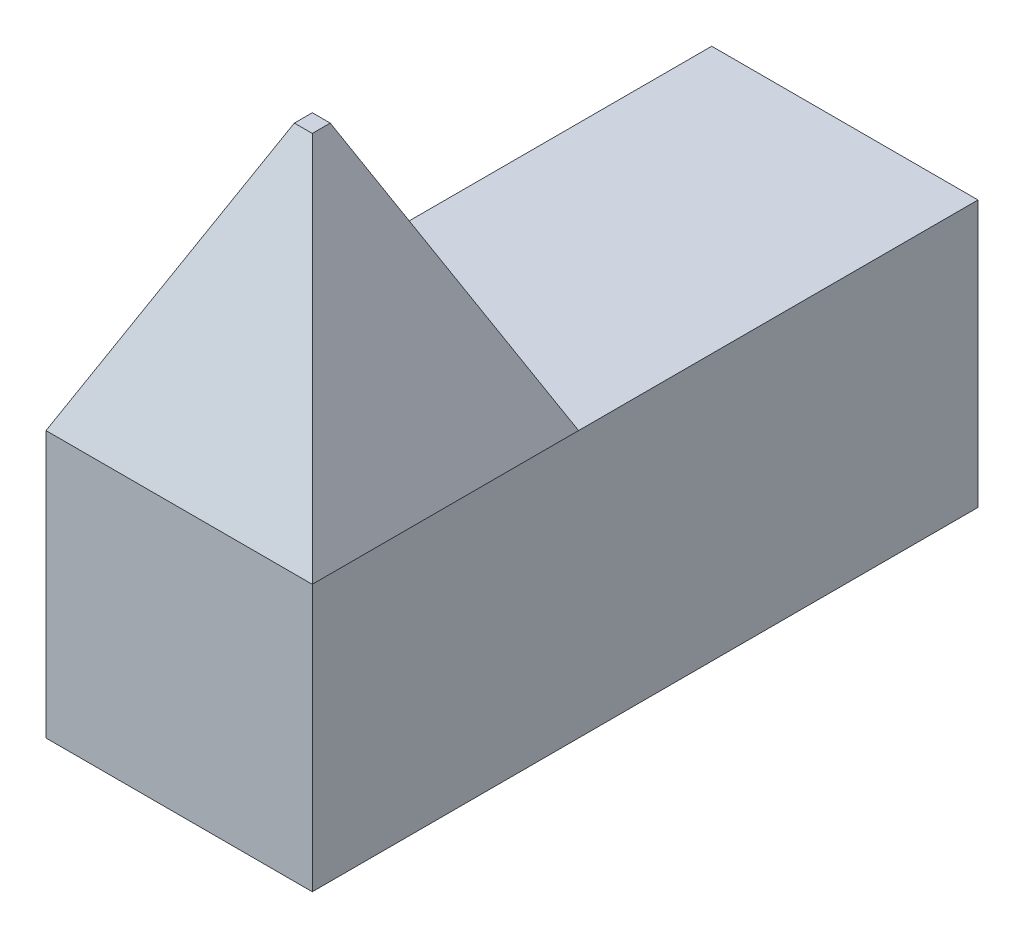
from build123d import *

# Parameters (mm, degrees)
SKETCH1_W           = 40
SKETCH1_H           = 40
BOSS_EXTRUDE1_DEPTH = 100
SKETCH2_W           = 40
SKETCH2_H           = 40
BOSS_EXTRUDE2_DEPTH = 40
BOSS_EXTRUDE2_TAPER = 25


with BuildPart() as part:
    # Sketch1 → Boss-Extrude1 (new body)
    with BuildSketch(Plane.XY):
        with Locations((20, 20)):
            Rectangle(SKETCH1_W, SKETCH1_H)
    extrude(amount=BOSS_EXTRUDE1_DEPTH)

    # Sketch2 → Boss-Extrude2 (add)
    with BuildSketch(Plane(origin=(0, 40, 0), x_dir=(1, 0, 0), z_dir=(0, 1, 0))):
        with Locations((20, -80)):
            Rectangle(SKETCH2_W, SKETCH2_H)
    extrude(amount=BOSS_EXTRUDE2_DEPTH, taper=BOSS_EXTRUDE2_TAPER)


solid = part.part
